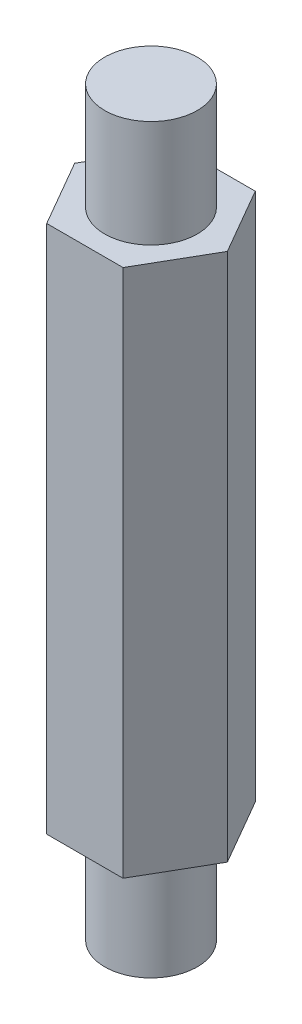
from build123d import *

# Parameters (mm, degrees)
BOSS_EXTRUDE1_DEPTH = 40
SKETCH5_R           = 3.5
BOSS_EXTRUDE2_DEPTH = 8.091605471
SKETCH5_2_R         = 3.5
BOSS_EXTRUDE3_DEPTH = 8
BOSS_EXTRUDE6_START = 8
SKETCH9_R           = 3.5
BOSS_EXTRUDE6_DEPTH = 8


with BuildPart() as part:
    # Sketch3 → Boss-Extrude1 (new body)
    with BuildSketch(Plane(origin=(0, 0, 0), x_dir=(1, 0, 0), z_dir=(0, 1, 0))):
        Polygon((-5.773502692, 0), (-2.886751346, -5), (2.886751346, -5), (5.773502692, 0), (2.886751346, 5), (-2.886751346, 5), align=None)
    extrude(amount=BOSS_EXTRUDE1_DEPTH)

    # Sketch5 → Boss-Extrude2 (add)
    with BuildSketch(Plane(origin=(0, 40, 0), x_dir=(1, 0, 0), z_dir=(0, 1, 0))):
        Circle(SKETCH5_R)
    extrude(amount=BOSS_EXTRUDE2_DEPTH)

    # Sketch5<2> → Boss-Extrude3 (add)
    with BuildSketch(Plane(origin=(0, 40, 0), x_dir=(1, 0, 0), z_dir=(0, 1, 0))):
        Circle(SKETCH5_2_R)
    extrude(amount=BOSS_EXTRUDE3_DEPTH)

    # Sketch9 → Boss-Extrude6 (add)
    with BuildSketch(Plane.XZ.offset(BOSS_EXTRUDE6_START)):
        Circle(SKETCH9_R)
    extrude(amount=-BOSS_EXTRUDE6_DEPTH)


solid = part.part
